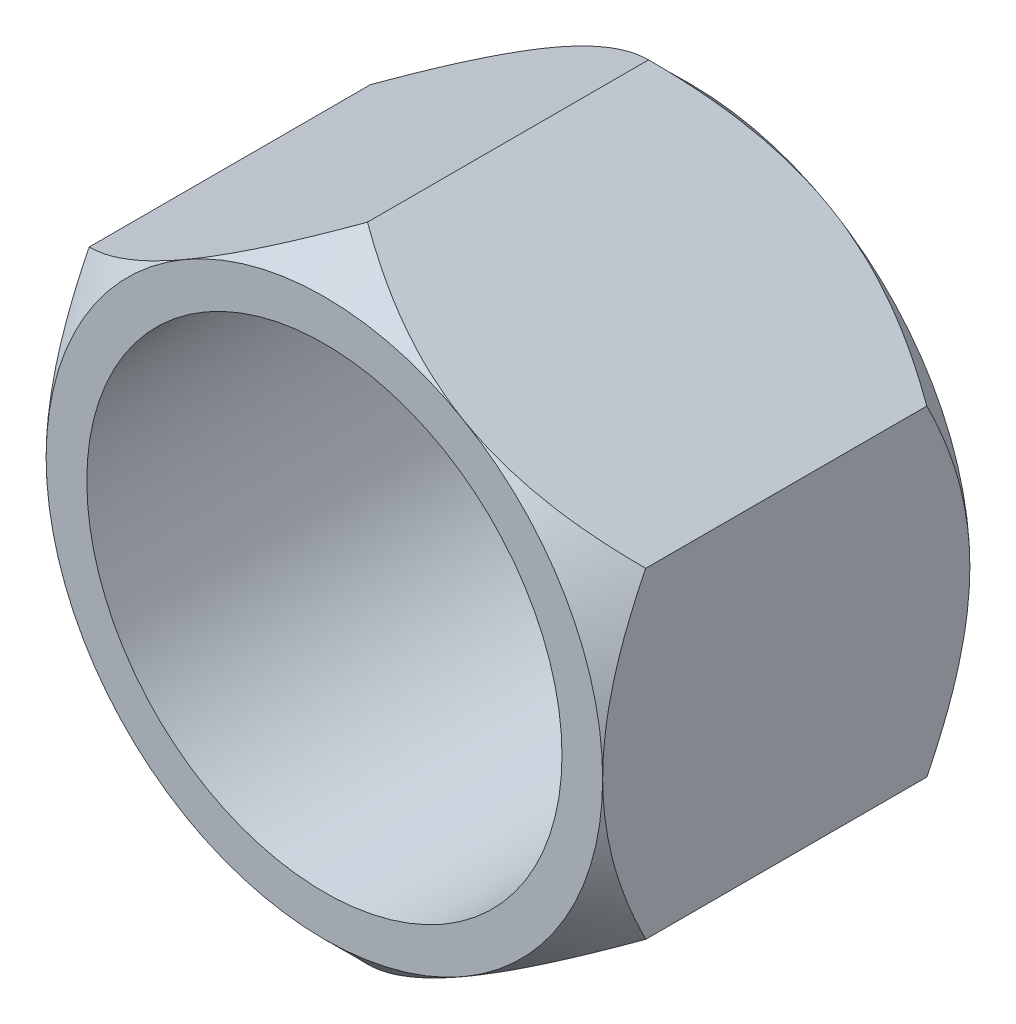
from build123d import *

# Parameters (mm, degrees)
SKETCH1_R           = 0.129403425
BOSS_EXTRUDE2_DEPTH = 0.2
SKETCH6_OUTSIDE_W   = 2.464
SKETCH6_OUTSIDE_H   = 2.51
SKETCH6_OUTSIDE_R   = 0.151554446
CUT_EXTRUDE1_DEPTH  = 0.03
CUT_EXTRUDE1_DRAFT  = -45
SKETCH7_OUTSIDE_W   = 2.464
SKETCH7_OUTSIDE_H   = 2.51
SKETCH7_OUTSIDE_R   = 0.151554446
CUT_EXTRUDE2_DEPTH  = 0.03
CUT_EXTRUDE2_DRAFT  = -45


with BuildPart() as part:
    # Sketch1 → Boss-Extrude2 (new body)
    with BuildSketch(Plane.XY):
        Polygon((0.151554446, 0.0875), (0, 0.175), (-0.151554446, 0.0875), (-0.151554446, -0.0875), (0, -0.175), (0.151554446, -0.0875), align=None)
        Circle(SKETCH1_R, mode=Mode.SUBTRACT)
    extrude(amount=BOSS_EXTRUDE2_DEPTH)


with BuildPart() as cut_extrude1_tool:
    # Sketch6 outside → Cut-Extrude1 (with draft: the straight prism first)
    with BuildSketch(Plane.XY.offset(0.2)):
        Rectangle(SKETCH6_OUTSIDE_W, SKETCH6_OUTSIDE_H)
        Circle(SKETCH6_OUTSIDE_R, mode=Mode.SUBTRACT)
    extrude(amount=-CUT_EXTRUDE1_DEPTH)
    # Cut-Extrude1: the draft: its side faces are tilted about the plane it starts from
    cut_extrude1_sides = [cut_extrude1_tool.faces().sort_by_distance(p)[0] for p in [
        (0, -1.255, 0.185),
        (1.232, 0, 0.185),
        (0, 1.255, 0.185),
        (-1.232, 0, 0.185),
        (-0.151554446, 0, 0.185),
    ]]
    draft(cut_extrude1_sides, Plane.XY.offset(0.2), CUT_EXTRUDE1_DRAFT)


with BuildPart() as part_1:
    add(part.part)

    # Cut-Extrude1: cut by cut_extrude1_tool
    add(cut_extrude1_tool.part, mode=Mode.SUBTRACT)


with BuildPart() as cut_extrude2_tool:
    # Sketch7 outside → Cut-Extrude2 (with draft: the straight prism first)
    with BuildSketch(Plane(origin=(0, 0, 0), x_dir=(-1, 0, 0), z_dir=(0, 0, -1))):
        Rectangle(SKETCH7_OUTSIDE_W, SKETCH7_OUTSIDE_H)
        Circle(SKETCH7_OUTSIDE_R, mode=Mode.SUBTRACT)
    extrude(amount=-CUT_EXTRUDE2_DEPTH)
    # Cut-Extrude2: the draft: its side faces are tilted about the plane it starts from
    cut_extrude2_sides = [cut_extrude2_tool.faces().sort_by_distance(p)[0] for p in [
        (0, -1.255, 0.015),
        (-1.232, 0, 0.015),
        (0, 1.255, 0.015),
        (1.232, 0, 0.015),
        (0.151554446, 0, 0.015),
    ]]
    draft(cut_extrude2_sides, Plane(origin=(0, 0, 0), x_dir=(-1, 0, 0), z_dir=(0, 0, -1)), CUT_EXTRUDE2_DRAFT)


with BuildPart() as part_2:
    add(part_1.part)

    # Cut-Extrude2: cut by cut_extrude2_tool
    add(cut_extrude2_tool.part, mode=Mode.SUBTRACT)


solid = part_2.part
